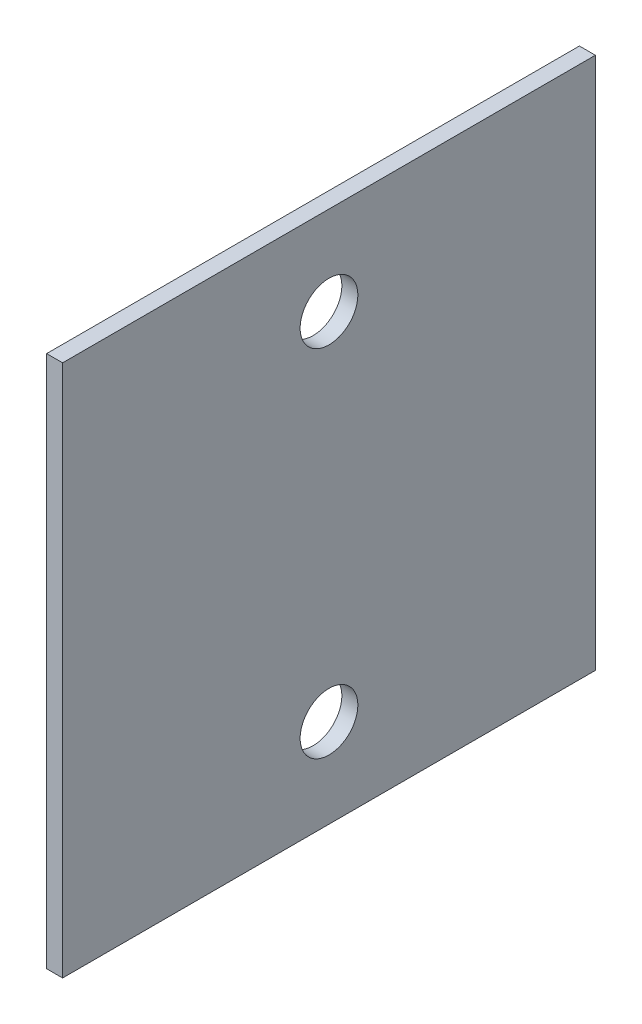
from build123d import *

# Parameters (mm, degrees)
SKETCH1_W                  = 60
SKETCH1_H                  = 60
BOSS_EXTRUDE1_DEPTH        = 1.8
F_6_5_6_5_DIAMETER_HOLE1_D = 6.5


with BuildPart() as part:
    # Sketch1 → Boss-Extrude1 (new body)
    with BuildSketch(Plane(origin=(0, 0, 0), x_dir=(0, 0, -1), z_dir=(1, 0, 0))):
        with Locations((-30, 0)):
            Rectangle(SKETCH1_W, SKETCH1_H)
    extrude(amount=BOSS_EXTRUDE1_DEPTH)

    # Ø6.5 (6.5) Diameter Hole1 (through all)
    with Locations(Plane(origin=(1.8, 0, 0), x_dir=(0, 0, -1), z_dir=(1, 0, 0))):
        with Locations((-30, -20), (-30, 20)):
            Hole(F_6_5_6_5_DIAMETER_HOLE1_D / 2)


solid = part.part
